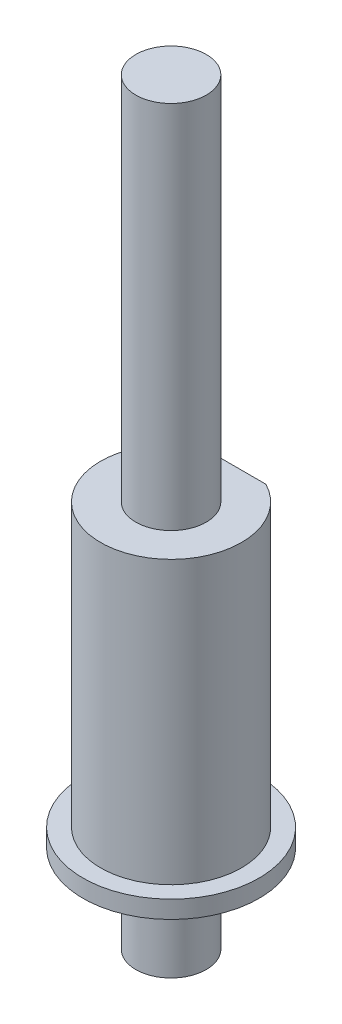
from build123d import *

# Parameters (mm, degrees)
SKETCH_1_R      = 1
EXTRUDE_1_DEPTH = 21.5
EXTRUDE_START   = -2.5
SKETCH_2_R      = 2.5
SKETCH_2_R_2    = 1
EXTRUDE_2_DEPTH = 0.5
SKETCH_3_R      = 1
EXTRUDE_3_DEPTH = 8


with BuildPart() as part:
    # 草图1 → 凸台-拉伸1 (new body)
    with BuildSketch(Plane(origin=(0, 0, 0), x_dir=(1, 0, 0), z_dir=(0, 1, 0))):
        with Locations(Location((0, 0, 0), (0, 0, 270))):
            Circle(SKETCH_1_R)
    extrude(amount=EXTRUDE_1_DEPTH)

    # 草图2 → 凸台-拉伸2 (add)
    with BuildSketch(Plane.XZ.offset(EXTRUDE_START)):
        with Locations(Location((0, 0, 0), (0, 0, 270))):
            Circle(SKETCH_2_R)
        with Locations(Location((0, 0, 0), (0, 0, 270))):
            Circle(SKETCH_2_R_2, mode=Mode.SUBTRACT)
    extrude(amount=-EXTRUDE_2_DEPTH)

    # 草图3 → 凸台-拉伸3 (add)
    with BuildSketch(Plane(origin=(0, 3, 0), x_dir=(-1, 0, 0), z_dir=(0, 1, 0))):
        with BuildLine():
            Line((-0.911921049, -1.78), (0.911921049, -1.78))
            ThreePointArc((0.911921049, -1.78), (0, 2), (-0.911921049, -1.78))
        make_face()
        with Locations(Location((0, 0, 0), (0, 0, 270))):
            Circle(SKETCH_3_R, mode=Mode.SUBTRACT)
    extrude(amount=EXTRUDE_3_DEPTH)


solid = part.part
